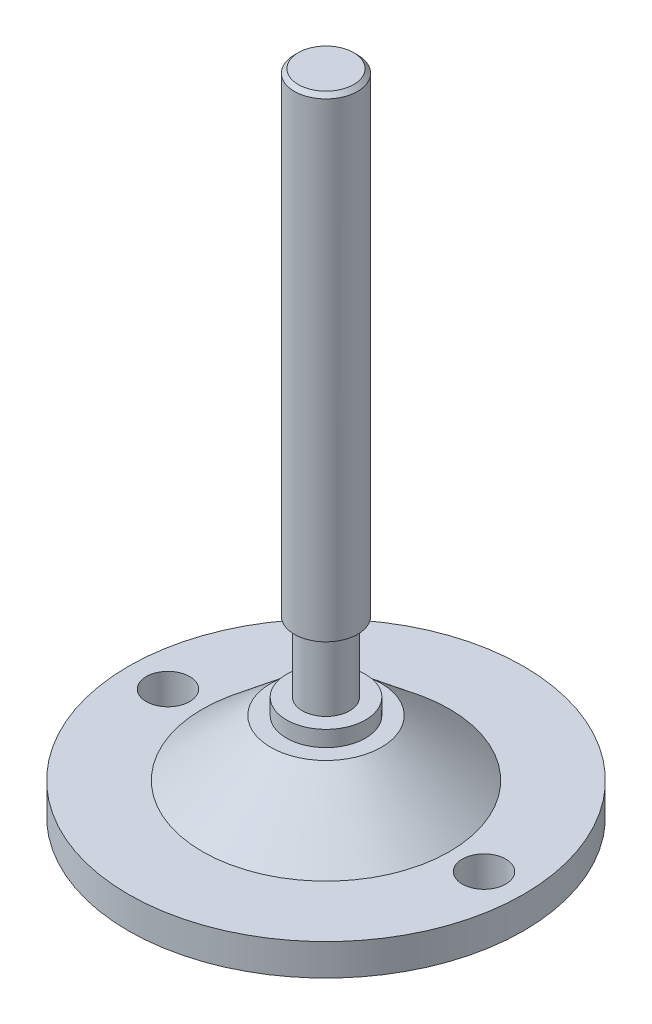
from build123d import *

# Parameters (mm, degrees)
CHANFREIN1_SIZE         = 0.5
ESQUISSE2_R             = 2.75
ENL_V_MAT_EXTRU_1_DEPTH = 90.297256397


with BuildPart() as part:
    # Esquisse1 → Révolution1 (revolve)
    with BuildSketch(Plane.XY, mode=Mode.PRIVATE) as r_volution1_sk:
        Polygon((0, 0), (25, 0), (25, 4), (15.632287961, 4), (7, 11.118702223), (5, 11.118702223), (5, 13.118702223), (3, 13.118702223), (3, 22), (4, 22), (4, 82), (0, 82), align=None)
    revolve(r_volution1_sk.sketch.rotate(Axis((0, 0, 0), (0, 1, 0)), 90), axis=Axis((0, 0, 0), (0, 1, 0)))

    # Chanfrein1
    chanfrein1_edges = [part.edges().sort_by_distance(p)[0] for p in [
        (0, 82, 4),
    ]]
    chamfer(chanfrein1_edges, length=CHANFREIN1_SIZE)

    # Esquisse2 → Enlèv. mat.-Extru.1 (cut, through all)
    with BuildSketch(Plane.XZ):
        with Locations(Location((-20, 0, 0), (0, 0, 270))):
            Circle(ESQUISSE2_R)
        with Locations(Location((20, 0, 0), (0, 0, 270))):
            Circle(ESQUISSE2_R)
    extrude(amount=-ENL_V_MAT_EXTRU_1_DEPTH, mode=Mode.SUBTRACT)


solid = part.part
